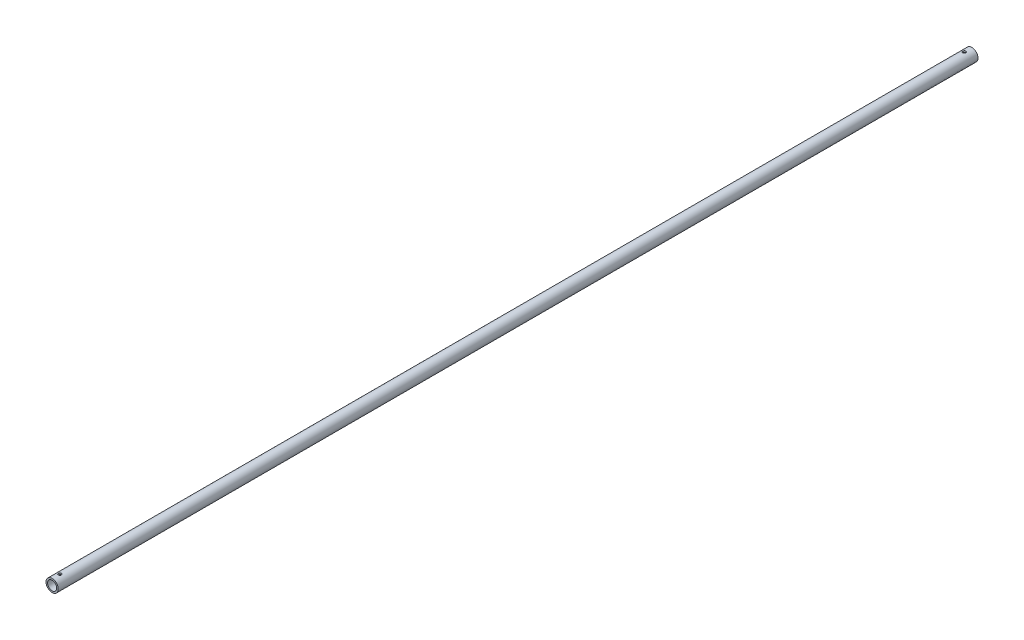
from build123d import *

# Parameters (mm, degrees)
EXTRUDE_1_DEPTH          = 300
EXTRUDE_1_DEPTH_BACK     = 300
SKETCH_1_R               = 4
SKETCH_1_R_2             = 3
CUT_EXTRUDE_2_DEPTH      = 301.053328593
CUT_EXTRUDE_2_DEPTH_BACK = 301.053328593
SKETCH_3_R               = 1


with BuildPart() as part:
    # 草图1 → 凸台-拉伸1 (new, two sides: drawn at the far end of the back side and taken through both)
    with BuildSketch(Plane.XY.offset(-EXTRUDE_1_DEPTH_BACK)):
        Circle(SKETCH_1_R)
        Circle(SKETCH_1_R_2, mode=Mode.SUBTRACT)
    extrude(amount=EXTRUDE_1_DEPTH + EXTRUDE_1_DEPTH_BACK)

    # 草图3 → 切除-拉伸2 (cut, two sides: drawn at the far end of the back side and taken through both)
    with BuildSketch(Plane(origin=(0, 0, 0), x_dir=(1, 0, 0), z_dir=(0, 1, 0)).offset(-CUT_EXTRUDE_2_DEPTH_BACK)):
        with Locations((0, 295)):
            Circle(SKETCH_3_R)
        with Locations((0, -295)):
            Circle(SKETCH_3_R)
    extrude(amount=CUT_EXTRUDE_2_DEPTH + CUT_EXTRUDE_2_DEPTH_BACK, mode=Mode.SUBTRACT)


solid = part.part
